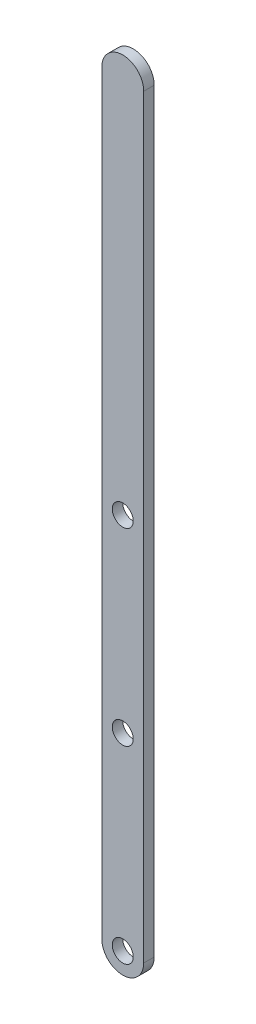
from build123d import *

# Parameters (mm, degrees)
SKETCH1_R           = 12.7
BOSS_EXTRUDE1_DEPTH = 12.7


with BuildPart() as part:
    # Sketch1 → Boss-Extrude1 (new body)
    with BuildSketch(Plane.XY):
        with BuildLine():
            Line((-25.4, -457.2), (-25.4, 0))
            Line((-25.4, 0), (-25.4, 457.2))
            ThreePointArc((-25.4, 457.2), (0, 482.6), (25.4, 457.2))
            Line((25.4, 457.2), (25.4, 0))
            Line((25.4, 0), (25.4, -457.2))
            ThreePointArc((25.4, -457.2), (0, -482.6), (-25.4, -457.2))
        make_face()
        Circle(SKETCH1_R, mode=Mode.SUBTRACT)
        with Locations((0, -457.2)):
            Circle(SKETCH1_R, mode=Mode.SUBTRACT)
        with Locations((0, -228.6)):
            Circle(SKETCH1_R, mode=Mode.SUBTRACT)
    extrude(amount=BOSS_EXTRUDE1_DEPTH)


solid = part.part
